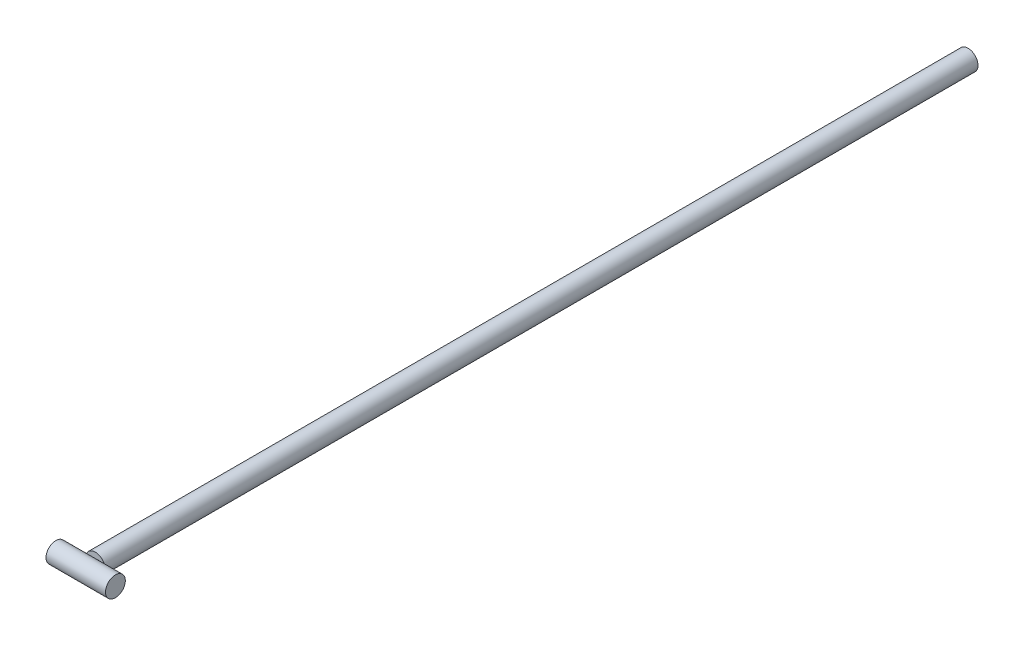
from build123d import *

# Parameters (mm, degrees)
SKETCH_1_R      = 2.5
EXTRUDE_1_DEPTH = 110
SKETCH_2_R      = 2.5
EXTRUDE_2_DEPTH = 7.5


with BuildPart() as part:
    # 草图1 → 凸台-拉伸1 (new, symmetric)
    with BuildSketch(Plane.XY):
        Circle(SKETCH_1_R)
    extrude(amount=EXTRUDE_1_DEPTH, both=True)

    # 草图2 → 凸台-拉伸2 (add)
    with BuildSketch(Plane(origin=(0, 0, 0), x_dir=(0, 0, -1), z_dir=(1, 0, 0))):
        with Locations(Location((-112.44047791, 0, 0), (0, 0, 12.527723759))):
            Circle(SKETCH_2_R)
    extrude_2 = extrude(amount=EXTRUDE_2_DEPTH)

    # 镜向1: 凸台-拉伸2 across plane
    add(extrude_2.mirror(Plane(origin=(0, 0, 0), x_dir=(0, 0, 1), z_dir=(1, 0, 0))))


solid = part.part
